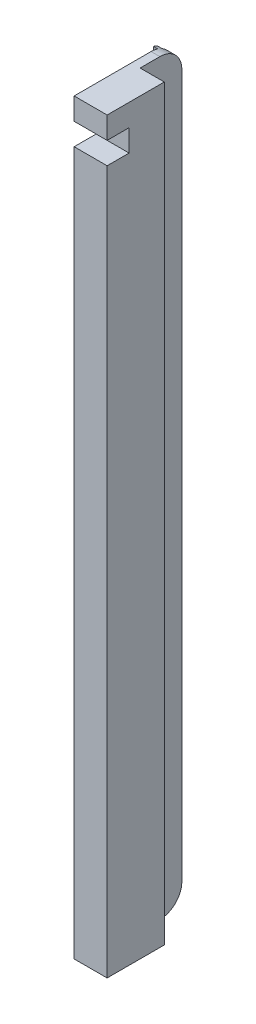
from build123d import *

# Parameters (mm, degrees)
EXTRUDE_1_DEPTH     = 26
SKETCH_1_4_W        = 4
SKETCH_1_4_H        = 340
EXTRUDE_2_DEPTH     = 19
FILLET_1_R          = 10
EXTRUDE_3_DEPTH     = 2
SKETCH_5_W          = 161
SKETCH_5_H          = 6
CUT_EXTRUDE_1_DEPTH = 52
SKETCH_6_W          = 156.446977918
SKETCH_6_H          = 480.108754565
CUT_EXTRUDE_3_DEPTH = 401
SKETCH_7_W          = 10
SKETCH_7_H          = 10
CUT_EXTRUDE_4_DEPTH = 401
EXTRUDE_4_DEPTH     = 2


with BuildPart() as part:
    # 스케치1 → 보스-돌출1 (new body)
    with BuildSketch(Plane.XY):
        Polygon((-168, 0), (168, 0), (183, 0), (183, -340), (168, -340), (168, -20), (-168, -20), (-168, -340), (-183, -340), (-183, 0), align=None)
    extrude(amount=EXTRUDE_1_DEPTH)

    # 스케치1<4> → 보스-돌출2 (add)
    with BuildSketch(Plane.XY):
        with Locations((-170, -170)):
            Rectangle(SKETCH_1_4_W, SKETCH_1_4_H)
        with Locations((170, -170)):
            Rectangle(SKETCH_1_4_W, SKETCH_1_4_H)
    extrude(amount=-EXTRUDE_2_DEPTH)

    # 필렛1
    fillet_1_edges = [part.edges().sort_by_distance(p)[0] for p in [
        (-170, 0, -19),
        (170, 0, -19),
        (170, -340, -19),
        (-170, -340, -19),
    ]]
    fillet(fillet_1_edges, radius=FILLET_1_R)

    # 스케치3 → 보스-돌출3 (add)
    with BuildSketch(Plane.ZY.offset(-168)):
        with BuildLine():
            Line((-12, -339.539392014), (-12, -0.460607986))
            ThreePointArc((-12, -0.460607986), (-13.02408013, -0.845395743), (-14, -1.339745962))
            Line((-14, -1.339745962), (-14, -338.660254038))
            ThreePointArc((-14, -338.660254038), (-13.02408013, -339.154604257), (-12, -339.539392014))
        make_face()
    extrude_3 = extrude(amount=EXTRUDE_3_DEPTH)

    # 대칭 복사1: 보스-돌출3 across plane
    add(extrude_3.mirror(Plane(origin=(0, 0, 0), x_dir=(0, 0, 1), z_dir=(1, 0, 0))))

    # 스케치5 → 컷-돌출1 (cut)
    with BuildSketch(Plane(origin=(0, 0, 0), x_dir=(1, 0, 0), z_dir=(0, 1, 0))):
        with Locations((-87.5, -3)):
            Rectangle(SKETCH_5_W, SKETCH_5_H)
        with Locations((87.5, -3)):
            Rectangle(SKETCH_5_W, SKETCH_5_H)
    extrude(amount=-CUT_EXTRUDE_1_DEPTH, mode=Mode.SUBTRACT)

    # 스케치6 → 컷-돌출3 (cut)
    with BuildSketch(Plane.ZY.offset(-168)):
        with Locations((6.474112075, -134.168402936)):
            Rectangle(SKETCH_6_W, SKETCH_6_H)
    extrude(amount=CUT_EXTRUDE_3_DEPTH, mode=Mode.SUBTRACT)

    # 스케치7 → 컷-돌출4 (cut)
    with BuildSketch(Plane.ZY.offset(-168)):
        with Locations((21, -15)):
            Rectangle(SKETCH_7_W, SKETCH_7_H)
    extrude(amount=-CUT_EXTRUDE_4_DEPTH, mode=Mode.SUBTRACT)

    # 스케치9 → 보스-돌출4 (add)
    with BuildSketch(Plane.ZY.offset(-168)):
        with BuildLine():
            Line((-14, -1.339745962), (-14, -338.660254038))
            ThreePointArc((-14, -338.660254038), (-13.02408013, -339.154604257), (-12, -339.539392014))
            Line((-12, -339.539392014), (-12, -0.460607986))
            ThreePointArc((-12, -0.460607986), (-13.02408013, -0.845395743), (-14, -1.339745962))
        make_face()
    extrude(amount=EXTRUDE_4_DEPTH)


solid = part.part
